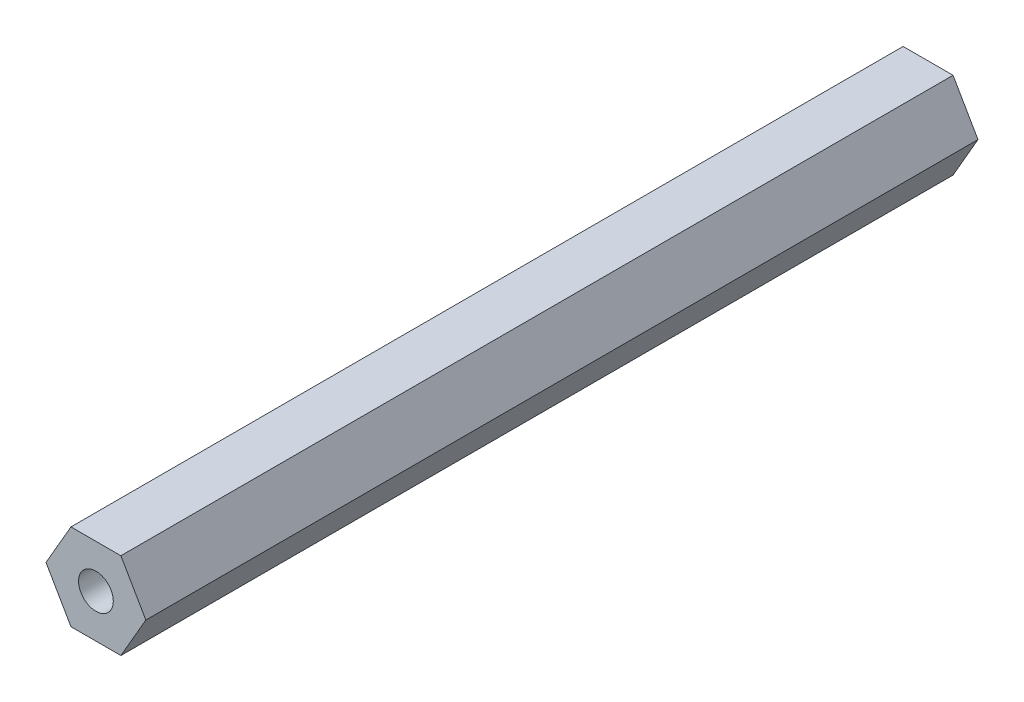
from build123d import *

# Parameters (mm, degrees)
SKETCH1_R           = 2.5527
BOSS_EXTRUDE1_DEPTH = 122.2375


with BuildPart() as part:
    # Sketch1 → Boss-Extrude1 (new body)
    with BuildSketch(Plane.XY):
        Polygon((7.332348419, 0), (3.666174209, 6.35), (-3.666174209, 6.35), (-7.332348419, 0), (-3.666174209, -6.35), (3.666174209, -6.35), align=None)
        Circle(SKETCH1_R, mode=Mode.SUBTRACT)
    extrude(amount=BOSS_EXTRUDE1_DEPTH)


solid = part.part
